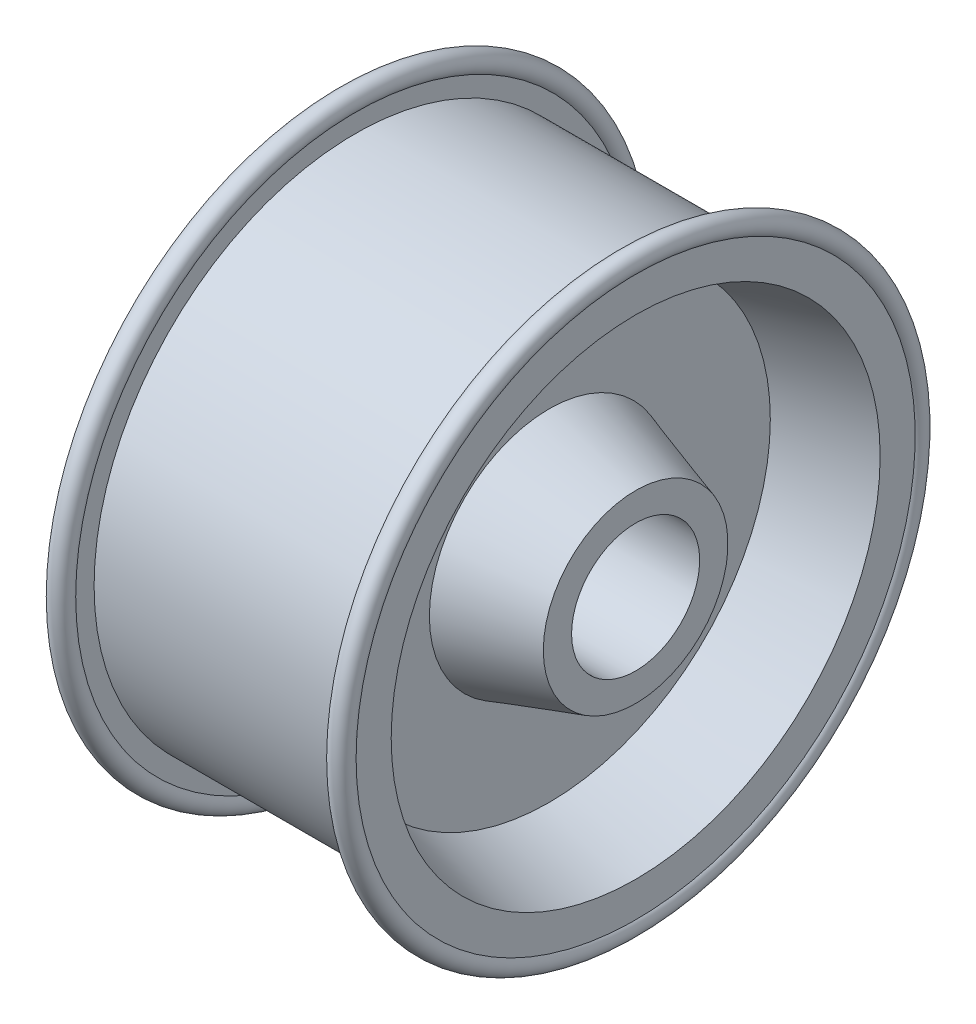
from build123d import *

# Parameters (mm, degrees)
F_3_8_0_3_DIAMETER_HOLE3_D = 7.62


with BuildPart() as part:
    # Sketch1 → Revolve4 (revolve)
    with BuildSketch(Plane.XY, mode=Mode.PRIVATE) as revolve4_sk:
        with BuildLine():
            Line((-34.306404062, 72.20748503), (-34.306404062, 67.460330901))
            Line((-34.306404062, 67.460330901), (34.306404062, 67.460330901))
            Line((34.306404062, 67.460330901), (34.306404062, 72.20748503))
            ThreePointArc((34.306404062, 72.20748503), (36.210218359, 76.803699328), (38.114032657, 72.20748503))
            Line((38.114032657, 72.20748503), (38.114032657, 63.144590546))
            Line((38.114032657, 63.144590546), (15.741916168, 57.15))
            Line((15.741916168, 57.15), (15.741916168, 30.913473054))
            Line((15.741916168, 30.913473054), (38.1, 23.841017964))
            Line((38.1, 23.841017964), (38.1, 16.540419162))
            Line((38.1, 16.540419162), (-38.1, 16.540419162))
            Line((-38.1, 16.540419162), (-38.1, 23.841017964))
            Line((-38.1, 23.841017964), (-15.741916168, 30.913473054))
            Line((-15.741916168, 30.913473054), (-15.741916168, 57.15))
            Line((-15.741916168, 57.15), (-38.114032657, 63.144590546))
            Line((-38.114032657, 63.144590546), (-38.114032657, 72.20748503))
            ThreePointArc((-38.114032657, 72.20748503), (-36.210218359, 76.803699328), (-34.306404062, 72.20748503))
        make_face()
    revolve(revolve4_sk.sketch.rotate(Axis((-841.873116512, 0, 0), (1, 0, 0)), 90), axis=Axis((-841.873116512, 0, 0), (1, 0, 0)))

    # 3/8 (0.3) Diameter Hole3 (through all)
    with Locations(Plane(origin=(15.741916168, 0, 0), x_dir=(0, 0, -1), z_dir=(1, 0, 0))):
        with Locations((0, 44.45)):
            Hole(F_3_8_0_3_DIAMETER_HOLE3_D / 2)


solid = part.part
